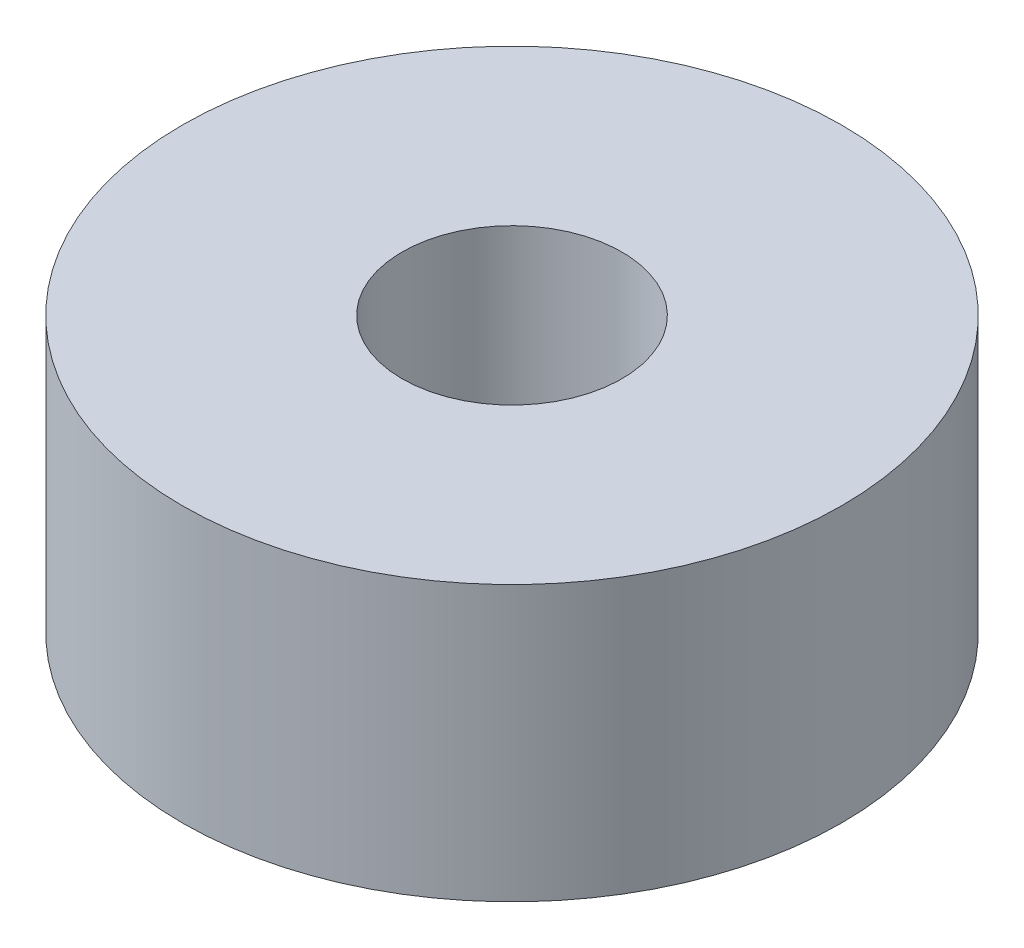
from build123d import *

# Parameters (mm, degrees)
SKETCH1_R           = 3
SKETCH1_R_2         = 1
BOSS_EXTRUDE1_DEPTH = 2.5


with BuildPart() as part:
    # Sketch1 → Boss-Extrude1 (new body)
    with BuildSketch(Plane(origin=(0, 0, 0), x_dir=(1, 0, 0), z_dir=(0, 1, 0))):
        with Locations(Location((0, 0, 0), (0, 0, 270))):
            Circle(SKETCH1_R)
        with Locations(Location((0, 0, 0), (0, 0, 270))):
            Circle(SKETCH1_R_2, mode=Mode.SUBTRACT)
    extrude(amount=BOSS_EXTRUDE1_DEPTH)


solid = part.part
